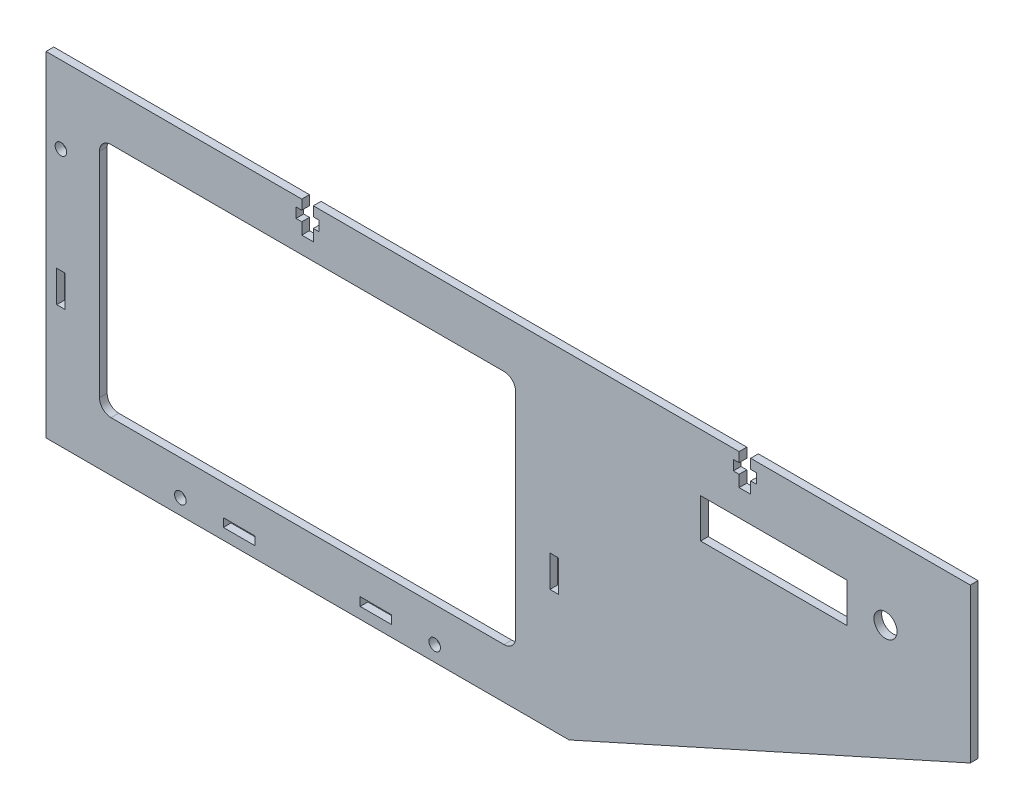
from build123d import *

# Parameters (mm, degrees)
SKETCH_1_R      = 1.5
SKETCH_1_W      = 8.2
SKETCH_1_H      = 2.2
SKETCH_1_W_2    = 2.2
SKETCH_1_H_2    = 8.2
SKETCH_1_R_2    = 3
EXTRUDE_1_DEPTH = 2


with BuildPart() as part:
    # 草图1 → 凸台-拉伸1 (new body)
    with BuildSketch(Plane.XY):
        Polygon((-68.061769393, -13.095981945), (-52.184883937, -13.095981945), (-18.934883937, -13.095981945), (18.565116063, -13.095981945), (67.695116063, -13.095981945), (171.815116063, 33.779018055), (171.815116063, 73.779018055), (114.815116063, 73.779018055), (114.815116063, 71.279018055), (116.315116063, 71.279018055), (116.315116063, 68.679018055), (114.815116063, 68.679018055), (114.815116063, 65.679018055), (111.815116063, 65.679018055), (111.815116063, 68.679018055), (110.315116063, 68.679018055), (110.315116063, 71.279018055), (111.815116063, 71.279018055), (111.815116063, 73.779018055), (1.315116063, 73.779018055), (1.315116063, 71.279018055), (2.815116063, 71.279018055), (2.815116063, 68.679018055), (1.315116063, 68.679018055), (1.315116063, 65.679018055), (-1.684883937, 65.679018055), (-1.684883937, 68.679018055), (-3.184883937, 68.679018055), (-3.184883937, 71.279018055), (-1.684883937, 71.279018055), (-1.684883937, 73.779018055), (-68.061769393, 73.779018055), align=None)
        with Locations((-33.184883937, -9.095981945)):
            Circle(SKETCH_1_R, mode=Mode.SUBTRACT)
        with Locations((-17.934883937, -9.095981946)):
            Rectangle(SKETCH_1_W, SKETCH_1_H, mode=Mode.SUBTRACT)
        with Locations((17.565116063, -9.095981946)):
            Rectangle(SKETCH_1_W, SKETCH_1_H, mode=Mode.SUBTRACT)
        with Locations((32.815116063, -9.095981945)):
            Circle(SKETCH_1_R, mode=Mode.SUBTRACT)
        with Locations((-64.184883937, 22.341518055)):
            Rectangle(SKETCH_1_W_2, SKETCH_1_H_2, mode=Mode.SUBTRACT)
        with Locations((63.815116063, 22.341518055)):
            Rectangle(SKETCH_1_W_2, SKETCH_1_H_2, mode=Mode.SUBTRACT)
        with BuildLine():
            ThreePointArc((50.815116063, 61.279018055), (52.936436406, 60.400338398), (53.815116063, 58.279018055))
            Line((53.815116063, 58.279018055), (53.815116063, 2.904018055))
            ThreePointArc((53.815116063, 2.904018055), (52.936436406, 0.782697711), (50.815116063, -0.095981945))
            Line((50.815116063, -0.095981945), (-51.184883937, -0.095981945))
            ThreePointArc((-51.184883937, -0.095981945), (-53.306204281, 0.782697711), (-54.184883937, 2.904018055))
            Line((-54.184883937, 2.904018055), (-54.184883937, 58.279018055))
            ThreePointArc((-54.184883937, 58.279018055), (-53.306204281, 60.400338398), (-51.184883937, 61.279018055))
            Line((-51.184883937, 61.279018055), (50.815116063, 61.279018055))
        make_face(mode=Mode.SUBTRACT)
        with Locations((-64.184883937, 53.779018055)):
            Circle(SKETCH_1_R, mode=Mode.SUBTRACT)
        Polygon((139.815116063, 48.679018055), (124.815116063, 48.679018055), (101.815116063, 48.679018055), (101.815116063, 58.879018055), (124.815116063, 58.879018055), (139.815116063, 58.879018055), align=None, mode=Mode.SUBTRACT)
        with Locations((149.815116063, 53.779018055)):
            Circle(SKETCH_1_R_2, mode=Mode.SUBTRACT)
    extrude(amount=EXTRUDE_1_DEPTH)


solid = part.part
